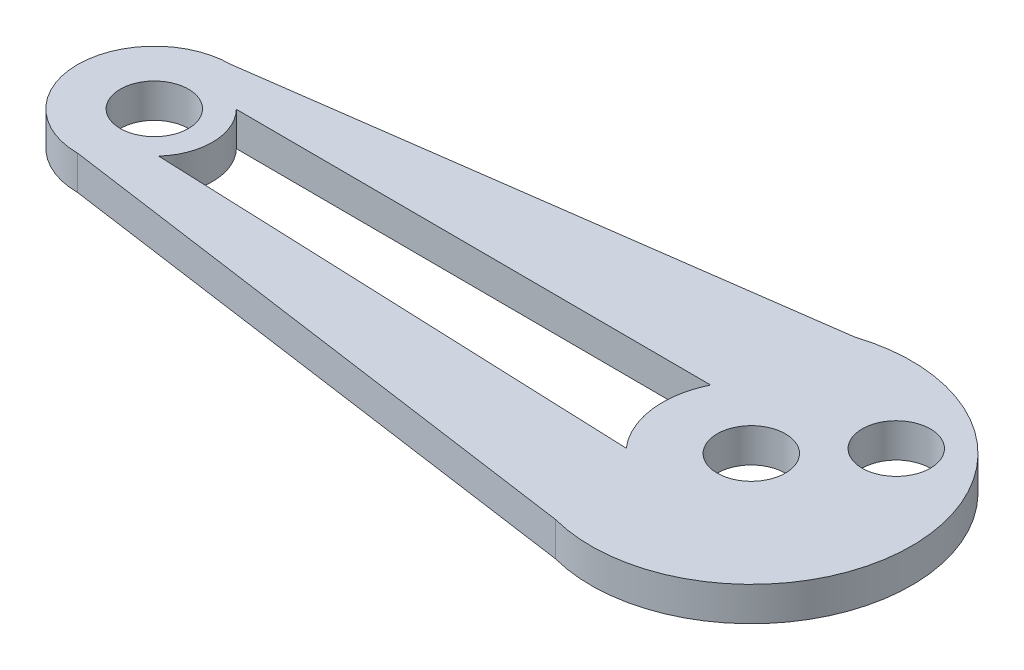
from build123d import *

# Parameters (mm, degrees)
SKETCH1_R           = 2
BOSS_EXTRUDE1_DEPTH = 2


with BuildPart() as part:
    # Sketch1 → Boss-Extrude1 (new body)
    with BuildSketch(Plane(origin=(0, 0, 0), x_dir=(1, 0, 0), z_dir=(0, 1, 0))):
        with BuildLine():
            Line((-51.630151438, -5.002739553), (-19.52046035, -0.558125845))
            ThreePointArc((-19.52046035, -0.558125845), (-7.23362406, -9.247253291), (-19.030151438, -18.591193767))
            Line((-19.030151438, -18.591193767), (-51.630151438, -14.002739553))
            ThreePointArc((-51.630151438, -14.002739553), (-56.130151438, -9.502739553), (-51.630151438, -5.002739553))
        make_face()
        with Locations(Location((-16.630151438, -9.502739553, 0), (0, 0, 270))):
            Circle(SKETCH1_R, mode=Mode.SUBTRACT)
        with Locations(Location((-51.630151438, -9.502739553, 0), (0, 0, 270))):
            Circle(SKETCH1_R, mode=Mode.SUBTRACT)
        with Locations(Location((-12.630151438, -5.002739553, 0), (0, 0, 270))):
            Circle(SKETCH1_R, mode=Mode.SUBTRACT)
        with BuildLine():
            Line((-49.20201043, -7.122796016), (-21.30201043, -7.219379406))
            ThreePointArc((-21.30201043, -7.219379406), (-21.78692763, -10.171813025), (-20.564614553, -12.902739553))
            Line((-20.564614553, -12.902739553), (-49.10201043, -11.776173749))
            ThreePointArc((-49.10201043, -11.776173749), (-48.230936244, -9.429691213), (-49.20201043, -7.122796016))
        make_face(mode=Mode.SUBTRACT)
    extrude(amount=BOSS_EXTRUDE1_DEPTH)


solid = part.part
